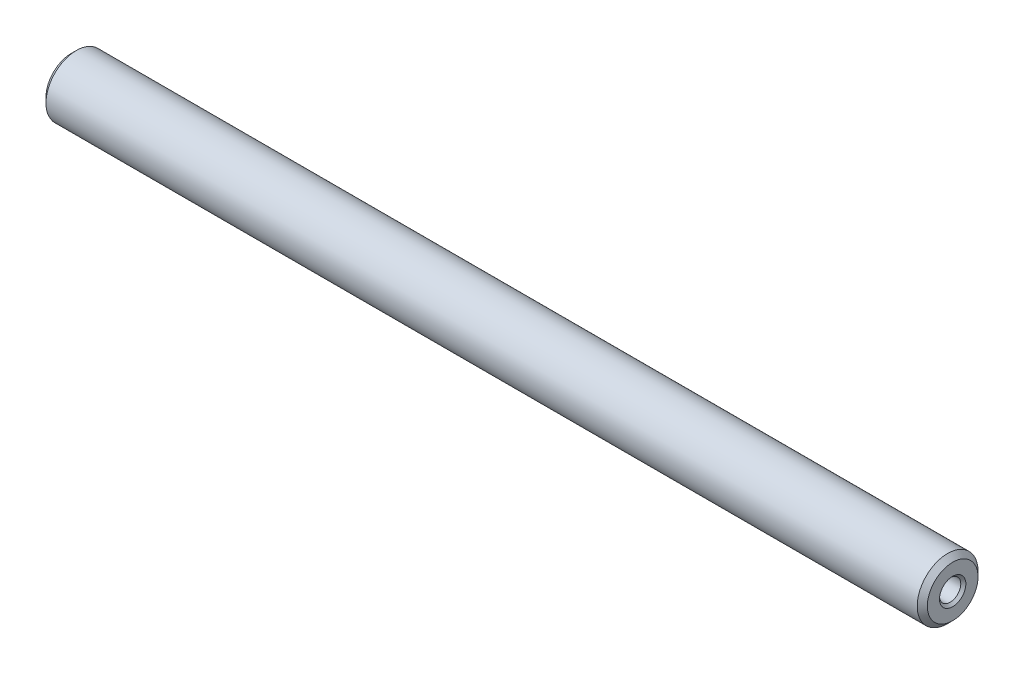
from build123d import *

# Parameters (mm, degrees)
SKETCH1_R             = 6
BOSS_EXTRUDE1_DEPTH   = 174
CHAMFER1_SIZE         = 1
M5_TAPPED_HOLE1_D     = 4.2
M5_TAPPED_HOLE1_DEPTH = 14
M5_TAPPED_HOLE1_TIP   = 1.2618073
CHAMFER2_SIZE         = 0.5
M5_TAPPED_HOLE2_D     = 4.2
M5_TAPPED_HOLE2_DEPTH = 14
M5_TAPPED_HOLE2_TIP   = 1.2618073
CHAMFER3_SIZE         = 0.5


with BuildPart() as part:
    # Sketch1 → Boss-Extrude1 (new body)
    with BuildSketch(Plane(origin=(0, 0, 0), x_dir=(0, 0, -1), z_dir=(1, 0, 0))):
        Circle(SKETCH1_R)
    extrude(amount=BOSS_EXTRUDE1_DEPTH)

    # Chamfer1
    chamfer1_edges = [part.edges().sort_by_distance(p)[0] for p in [
        (0, 0, 6),
        (174, 0, 6),
    ]]
    chamfer(chamfer1_edges, length=CHAMFER1_SIZE)

    # M5 Tapped Hole1
    with Locations(Plane(origin=(174, 0, 0), x_dir=(0, 0, -1), z_dir=(1, 0, 0))):
        with Locations((0, 0)):
            Hole(M5_TAPPED_HOLE1_D / 2, depth=M5_TAPPED_HOLE1_DEPTH)
            with Locations((0, 0, -(M5_TAPPED_HOLE1_DEPTH + M5_TAPPED_HOLE1_TIP / 2))):  # 118° drill point
                Cone(0, M5_TAPPED_HOLE1_D / 2, M5_TAPPED_HOLE1_TIP, mode=Mode.SUBTRACT)

    # Chamfer2
    chamfer2_edges = [part.edges().sort_by_distance(p)[0] for p in [
        (174, 0, -2.1),
    ]]
    chamfer(chamfer2_edges, length=CHAMFER2_SIZE)

    # M5 Tapped Hole2
    with Locations(Plane.ZY):
        with Locations((0, 0)):
            Hole(M5_TAPPED_HOLE2_D / 2, depth=M5_TAPPED_HOLE2_DEPTH)
            with Locations((0, 0, -(M5_TAPPED_HOLE2_DEPTH + M5_TAPPED_HOLE2_TIP / 2))):  # 118° drill point
                Cone(0, M5_TAPPED_HOLE2_D / 2, M5_TAPPED_HOLE2_TIP, mode=Mode.SUBTRACT)

    # Chamfer3
    chamfer3_edges = [part.edges().sort_by_distance(p)[0] for p in [
        (0, 0, 2.1),
    ]]
    chamfer(chamfer3_edges, length=CHAMFER3_SIZE)


solid = part.part
